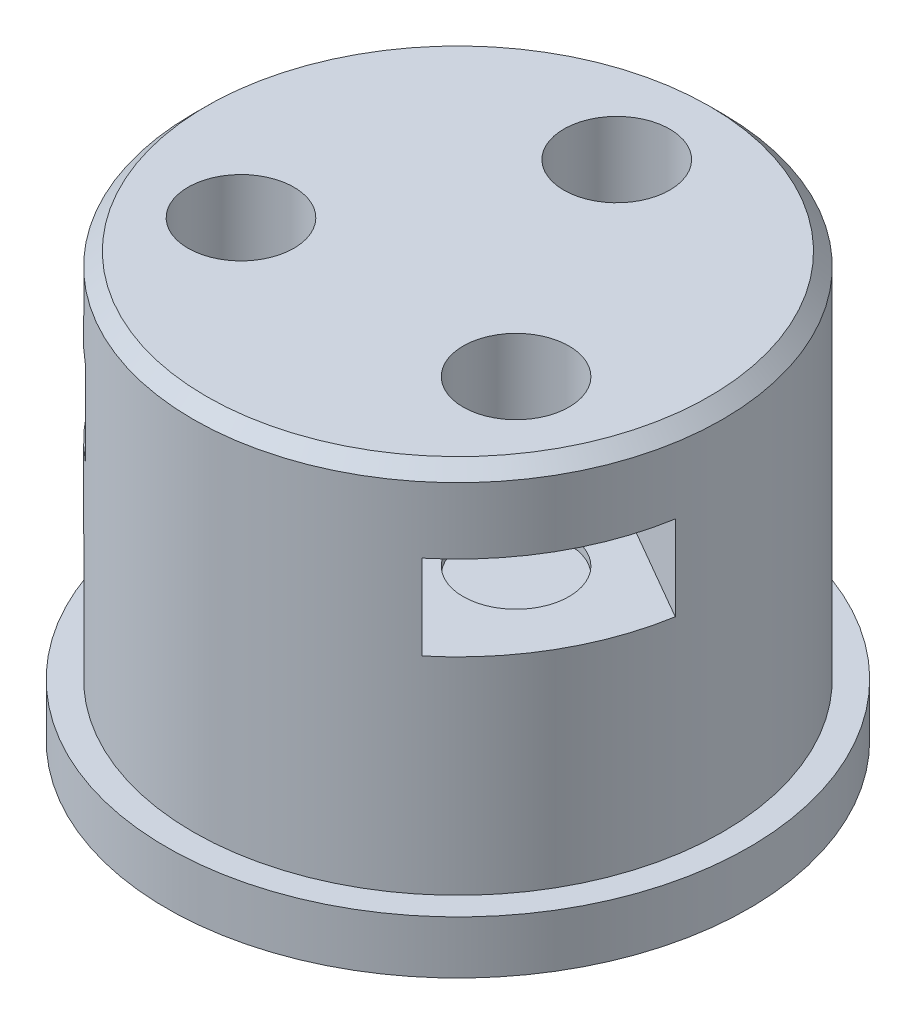
from build123d import *

# Parameters (mm, degrees)
SKETCH1_R           = 10
BOSS_EXTRUDE1_DEPTH = 16
SKETCH2_R           = 11
SKETCH2_R_2         = 10
BOSS_EXTRUDE2_DEPTH = 2
SKETCH3_R           = 8
CUT_EXTRUDE1_DEPTH  = 6.5
SKETCH4_R           = 2
CUT_EXTRUDE2_DEPTH  = 6.5
CUT_EXTRUDE3_START  = -3
SKETCH5_R           = 2
CUT_EXTRUDE3_DEPTH  = 3.2
BOSS_EXTRUDE3_START = -5
SKETCH6_R           = 8
SKETCH6_R_2         = 7
BOSS_EXTRUDE3_DEPTH = 1.5
CHAMFER1_SIZE       = 0.5


with BuildPart() as part:
    # Sketch1 → Boss-Extrude1 (new body)
    with BuildSketch(Plane(origin=(0, 0, 0), x_dir=(1, 0, 0), z_dir=(0, 1, 0))):
        with Locations(Location((0, 0, 0), (0, 0, 270))):
            Circle(SKETCH1_R)
    extrude(amount=BOSS_EXTRUDE1_DEPTH)

    # Sketch2 → Boss-Extrude2 (add)
    with BuildSketch(Plane.XZ):
        with Locations(Location((0, 0, 0), (0, 0, 270))):
            Circle(SKETCH2_R)
        with Locations(Location((0, 0, 0), (0, 0, 270))):
            Circle(SKETCH2_R_2, mode=Mode.SUBTRACT)
    extrude(amount=-BOSS_EXTRUDE2_DEPTH)

    # Sketch3 → Cut-Extrude1 (cut)
    with BuildSketch(Plane.XZ):
        with Locations(Location((0, 0, 0), (0, 0, 270))):
            Circle(SKETCH3_R)
    extrude(amount=-CUT_EXTRUDE1_DEPTH, mode=Mode.SUBTRACT)

    # Sketch4 → Cut-Extrude2 (cut)
    with BuildSketch(Plane(origin=(0, 16, 0), x_dir=(1, 0, 0), z_dir=(0, 1, 0))):
        with Locations(Location((0, 6, 0), (0, 0, 270))):
            Circle(SKETCH4_R)
        with Locations(Location((5.196152423, -3, 0), (0, 0, 270))):
            Circle(SKETCH4_R)
        with Locations(Location((-5.196152423, -3, 0), (0, 0, 270))):
            Circle(SKETCH4_R)
    extrude(amount=-CUT_EXTRUDE2_DEPTH, mode=Mode.SUBTRACT)

    # Sketch5 → Cut-Extrude3 (cut)
    # profile 1 of 3: a face of its own
    with BuildSketch(Plane(origin=(0, 16, 0), x_dir=(1, 0, 0), z_dir=(0, 1, 0)).offset(CUT_EXTRUDE3_START)):
        with BuildLine():
            Line((-3.5, 9.367496998), (-3.5, 3.979274058))
            Line((-3.5, 3.979274058), (0, 1.958548116))
            Line((0, 1.958548116), (3.5, 3.979274058))
            Line((3.5, 3.979274058), (3.5, 9.367496998))
            ThreePointArc((3.5, 9.367496998), (0, 10), (-3.5, 9.367496998))
        make_face()
        with Locations(Location((0, 6, 0), (0, 0, 270))):
            Circle(SKETCH5_R, mode=Mode.SUBTRACT)
    # profile 2 of 3: a face of its own
    with BuildSketch(Plane(origin=(0, 16, 0), x_dir=(1, 0, 0), z_dir=(0, 1, 0)).offset(CUT_EXTRUDE3_START)):
        with BuildLine():
            ThreePointArc((-9.86249037, -1.652659586), (-8.660254038, -5), (-6.36249037, -7.714837412))
            Line((-6.36249037, -7.714837412), (-1.696152423, -5.020725942))
            Line((-1.696152423, -5.020725942), (-1.696152423, -0.979274058))
            Line((-1.696152423, -0.979274058), (-5.196152423, 1.041451884))
            Line((-5.196152423, 1.041451884), (-9.86249037, -1.652659586))
        make_face()
        with Locations(Location((-5.196152423, -3, 0), (0, 0, 270))):
            Circle(SKETCH5_R, mode=Mode.SUBTRACT)
    # profile 3 of 3: a face of its own
    with BuildSketch(Plane(origin=(0, 16, 0), x_dir=(1, 0, 0), z_dir=(0, 1, 0)).offset(CUT_EXTRUDE3_START)):
        with BuildLine():
            Line((9.86249037, -1.652659586), (5.196152423, 1.041451884))
            Line((5.196152423, 1.041451884), (1.696152423, -0.979274058))
            Line((1.696152423, -0.979274058), (1.696152423, -5.020725942))
            Line((1.696152423, -5.020725942), (6.36249037, -7.714837412))
            ThreePointArc((6.36249037, -7.714837412), (8.660254038, -5), (9.86249037, -1.652659586))
        make_face()
        with Locations(Location((5.196152423, -3, 0), (0, 0, 270))):
            Circle(SKETCH5_R, mode=Mode.SUBTRACT)
    extrude(amount=-CUT_EXTRUDE3_DEPTH, mode=Mode.SUBTRACT)

    # Sketch6 → Boss-Extrude3 (add)
    with BuildSketch(Plane.XZ.offset(BOSS_EXTRUDE3_START)):
        with Locations(Location((0, 0, 0), (0, 0, 270))):
            Circle(SKETCH6_R)
        with Locations(Location((0, 0, 0), (0, 0, 270))):
            Circle(SKETCH6_R_2, mode=Mode.SUBTRACT)
    extrude(amount=-BOSS_EXTRUDE3_DEPTH)

    # Chamfer1
    chamfer1_edges = [part.edges().sort_by_distance(p)[0] for p in [
        (0, 16, -10),
    ]]
    chamfer(chamfer1_edges, length=CHAMFER1_SIZE)


solid = part.part
